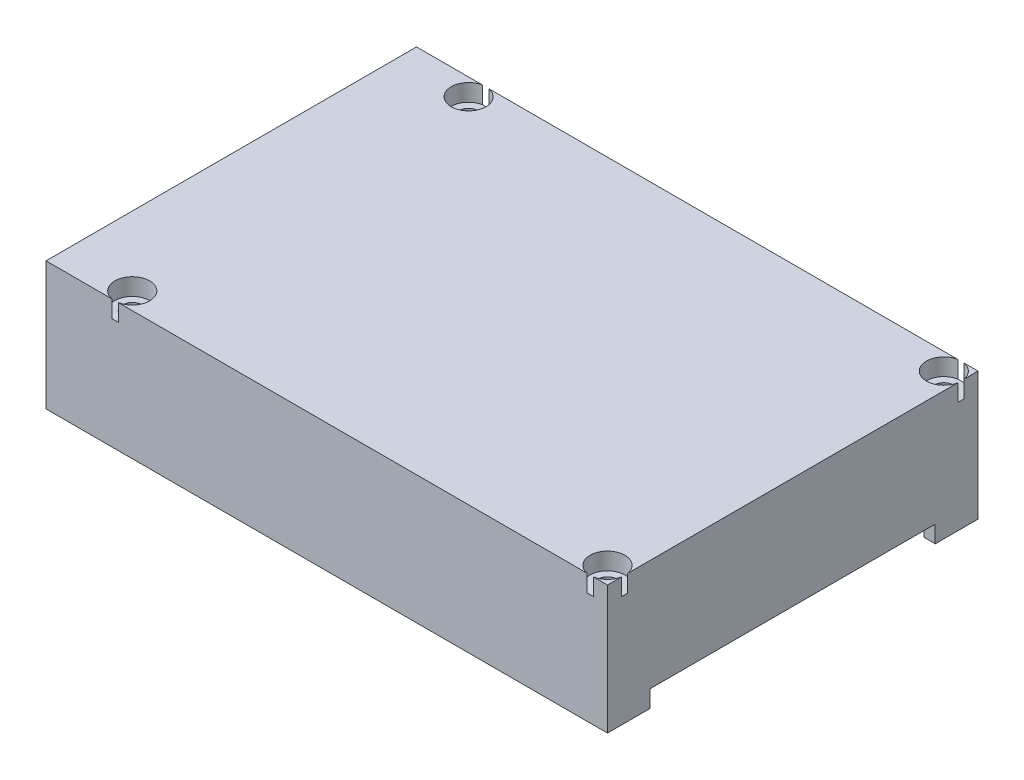
from build123d import *

# Parameters (mm, degrees)
SKETCH_1_W           = 98.5
SKETCH_1_H           = 65
EXTRUDE_1_DEPTH      = 3.5
SKETCH_2_W           = 98.5
SKETCH_2_H           = 65
SKETCH_2_W_2         = 94.5
SKETCH_2_H_2         = 62
EXTRUDE_2_DEPTH      = 19
SKETCH_9_R           = 1.75
CUT_EXTRUDE_7_DEPTH  = 64.151108462
SKETCH_10_R          = 2.25
SKETCH_10_R_2        = 1.75
EXTRUDE_6_DEPTH      = 19
SKETCH_11_W          = 8.5
SKETCH_11_H          = 15.9
CUT_EXTRUDE_8_DEPTH  = 7
SKETCH_12_W          = 50
SKETCH_12_H          = 6
CUT_EXTRUDE_9_DEPTH  = 7
SKETCH_13_R          = 3.05
CUT_EXTRUDE_10_DEPTH = 3


with BuildPart() as part:
    # 草图1 → 凸台-拉伸1 (new body)
    with BuildSketch(Plane(origin=(0, 0, 0), x_dir=(1, 0, 0), z_dir=(0, 1, 0))):
        Rectangle(SKETCH_1_W, SKETCH_1_H)
    extrude(amount=EXTRUDE_1_DEPTH)

    # 草图2 → 凸台-拉伸2 (add)
    with BuildSketch(Plane(origin=(0, 0, 0), x_dir=(-1, 0, 0), z_dir=(0, -1, 0))):
        Rectangle(SKETCH_2_W, SKETCH_2_H)
        Rectangle(SKETCH_2_W_2, SKETCH_2_H_2, mode=Mode.SUBTRACT)
    extrude(amount=EXTRUDE_2_DEPTH)

    # 草图9 → 切除-拉伸7 (cut, through all)
    with BuildSketch(Plane(origin=(0, 3.5, 0), x_dir=(1, 0, 0), z_dir=(0, 1, 0))):
        with Locations(Location((46.25, 29.5, 0), (0, 0, 270))):
            Circle(SKETCH_9_R)
        with Locations(Location((46.25, -29.5, 0), (0, 0, 270))):
            Circle(SKETCH_9_R)
        with Locations(Location((-37.117, 29.5, 0), (0, 0, 270))):
            Circle(SKETCH_9_R)
        with Locations(Location((-37.117, -29.5, 0), (0, 0, 270))):
            Circle(SKETCH_9_R)
    extrude(amount=-CUT_EXTRUDE_7_DEPTH, mode=Mode.SUBTRACT)

    # 草图10 → 凸台-拉伸6 (add, through all)
    # profile 1 of 4: a face of its own
    with BuildSketch(Plane(origin=(0, 0, 0), x_dir=(-1, 0, 0), z_dir=(0, -1, 0))):
        with Locations((-46.25, 29.5)):
            Circle(SKETCH_10_R)
        with Locations(Location((-46.25, 29.5, 0), (0, 0, 270))):
            Circle(SKETCH_10_R_2, mode=Mode.SUBTRACT)
    # profile 2 of 4: a face of its own
    with BuildSketch(Plane(origin=(0, 0, 0), x_dir=(-1, 0, 0), z_dir=(0, -1, 0))):
        with Locations((37.117, 29.5)):
            Circle(SKETCH_10_R)
        with Locations(Location((37.117, 29.5, 0), (0, 0, 270))):
            Circle(SKETCH_10_R_2, mode=Mode.SUBTRACT)
    # profile 3 of 4: a face of its own
    with BuildSketch(Plane(origin=(0, 0, 0), x_dir=(-1, 0, 0), z_dir=(0, -1, 0))):
        with Locations((-46.25, -29.5)):
            Circle(SKETCH_10_R)
        with Locations(Location((-46.25, -29.5, 0), (0, 0, 270))):
            Circle(SKETCH_10_R_2, mode=Mode.SUBTRACT)
    # profile 4 of 4: a face of its own
    with BuildSketch(Plane(origin=(0, 0, 0), x_dir=(-1, 0, 0), z_dir=(0, -1, 0))):
        with Locations((37.117, -29.5)):
            Circle(SKETCH_10_R)
        with Locations(Location((37.117, -29.5, 0), (0, 0, 270))):
            Circle(SKETCH_10_R_2, mode=Mode.SUBTRACT)
    extrude(amount=EXTRUDE_6_DEPTH)

    # 草图11 → 切除-拉伸8 (cut)
    with BuildSketch(Plane(origin=(0, -19, 0), x_dir=(-1, 0, 0), z_dir=(0, -1, 0))):
        with Locations((45, 24.55)):
            Rectangle(SKETCH_11_W, SKETCH_11_H)
    extrude(amount=-CUT_EXTRUDE_8_DEPTH, mode=Mode.SUBTRACT)

    # 草图12 → 切除-拉伸9 (cut)
    with BuildSketch(Plane(origin=(49.25, 0, 0), x_dir=(0, 0, -1), z_dir=(1, 0, 0))):
        with Locations((0, -19)):
            Rectangle(SKETCH_12_W, SKETCH_12_H)
    extrude(amount=-CUT_EXTRUDE_9_DEPTH, mode=Mode.SUBTRACT)

    # 草图13 → 切除-拉伸10 (cut)
    with BuildSketch(Plane(origin=(0, 3.5, 0), x_dir=(1, 0, 0), z_dir=(0, 1, 0))):
        with Locations((-37.117, 29.5)):
            Circle(SKETCH_13_R)
        with Locations((46.25, 29.5)):
            Circle(SKETCH_13_R)
        with Locations((46.25, -29.5)):
            Circle(SKETCH_13_R)
        with Locations((-37.117, -29.5)):
            Circle(SKETCH_13_R)
    extrude(amount=-CUT_EXTRUDE_10_DEPTH, mode=Mode.SUBTRACT)


solid = part.part
